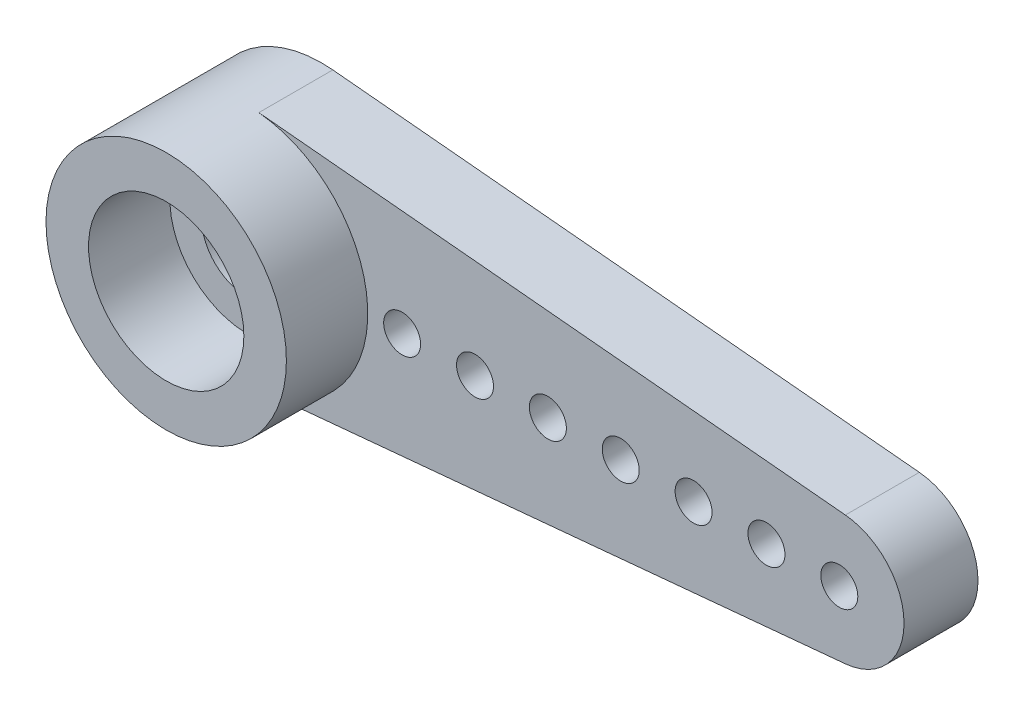
from build123d import *

# Parameters (mm, degrees)
ESBO_O1_R                = 1.25
ESBO_O1_R_2              = 0.5
RESSALTO_EXTRUS_O1_DEPTH = 2
ESBO_O2_R                = 3.25
ESBO_O2_R_2              = 2.1
RESSALTO_EXTRUS_O2_DEPTH = 2.2


with BuildPart() as part:
    # Esboço1 → Ressalto-extrusão1 (new body)
    with BuildSketch(Plane.XY):
        with BuildLine():
            Line((16.1640625, 1.742292598), (0.3046875, 3.235686253))
            ThreePointArc((0.3046875, 3.235686253), (-3.25, 0), (0.3046875, -3.235686253))
            Line((0.3046875, -3.235686253), (16.1640625, -1.742292598))
            ThreePointArc((16.1640625, -1.742292598), (17.75, 0), (16.1640625, 1.742292598))
        make_face()
        Circle(ESBO_O1_R, mode=Mode.SUBTRACT)
        with Locations((16, 0)):
            Circle(ESBO_O1_R_2, mode=Mode.SUBTRACT)
        with Locations((14.03, 0)):
            Circle(ESBO_O1_R_2, mode=Mode.SUBTRACT)
        with Locations((12.06, 0)):
            Circle(ESBO_O1_R_2, mode=Mode.SUBTRACT)
        with Locations((10.09, 0)):
            Circle(ESBO_O1_R_2, mode=Mode.SUBTRACT)
        with Locations((8.12, 0)):
            Circle(ESBO_O1_R_2, mode=Mode.SUBTRACT)
        with Locations((6.15, 0)):
            Circle(ESBO_O1_R_2, mode=Mode.SUBTRACT)
        with Locations((4.18, 0)):
            Circle(ESBO_O1_R_2, mode=Mode.SUBTRACT)
    extrude(amount=RESSALTO_EXTRUS_O1_DEPTH)

    # Esboço2 → Ressalto-extrusão2 (add)
    with BuildSketch(Plane.XY.offset(2)):
        with Locations(Location((0, 0, 0), (0, 0, 275.379378991))):
            Circle(ESBO_O2_R)
        Circle(ESBO_O2_R_2, mode=Mode.SUBTRACT)
    extrude(amount=RESSALTO_EXTRUS_O2_DEPTH)


solid = part.part
